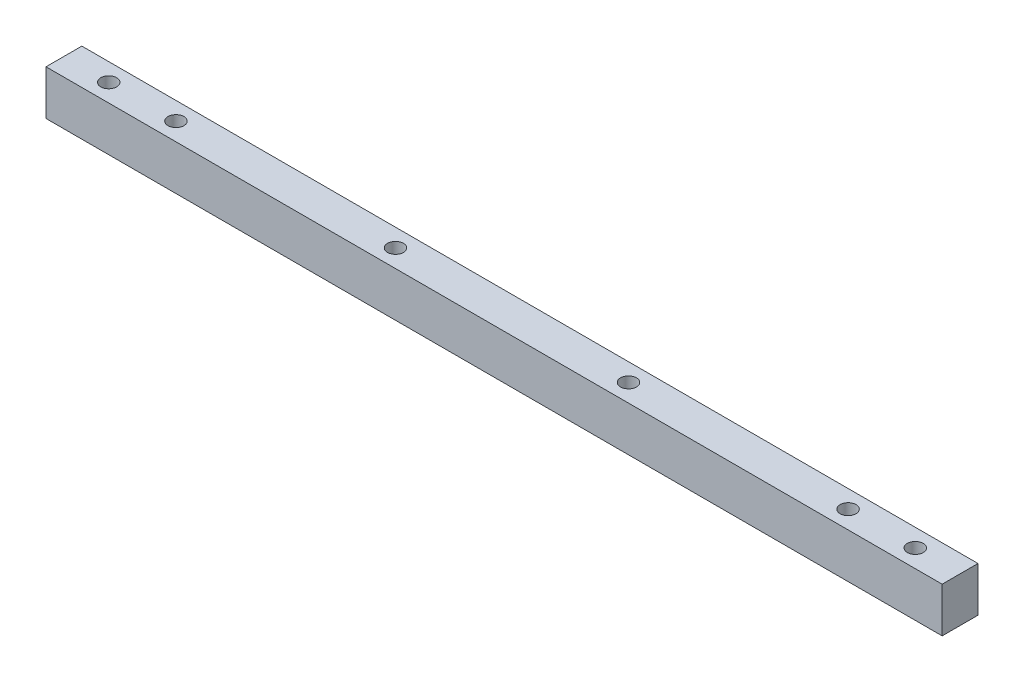
from build123d import *

# Parameters (mm, degrees)
SKETCH1_W           = 200
SKETCH1_H           = 8
BOSS_EXTRUDE1_DEPTH = 10
SKETCH2_R           = 1.775
CUT_EXTRUDE1_DEPTH  = 108.045777637
SKETCH3_R           = 1.775
CUT_EXTRUDE2_DEPTH  = 108.045777637


with BuildPart() as part:
    # Sketch1 → Boss-Extrude1 (new body)
    with BuildSketch(Plane(origin=(0, 0, 0), x_dir=(1, 0, 0), z_dir=(0, 1, 0))):
        with Locations((6.494727973, 0.203739262)):
            Rectangle(SKETCH1_W, SKETCH1_H)
    extrude(amount=BOSS_EXTRUDE1_DEPTH)

    # Sketch2 → Cut-Extrude1 (cut, through all)
    with BuildSketch(Plane(origin=(0, 10, 0), x_dir=(1, 0, 0), z_dir=(0, 1, 0))):
        with Locations(Location((-19.505272027, 0.203739262, 0), (0, 0, 270))):
            Circle(SKETCH2_R)
        with Locations(Location((32.494727973, 0.203739262, 0), (0, 0, 270))):
            Circle(SKETCH2_R)
    extrude(amount=-CUT_EXTRUDE1_DEPTH, mode=Mode.SUBTRACT)

    # Sketch3 → Cut-Extrude2 (cut, through all)
    with BuildSketch(Plane(origin=(0, 10, 0), x_dir=(1, 0, 0), z_dir=(0, 1, 0))):
        with Locations(Location((-83.505272027, 0.203739262, 0), (0, 0, 270))):
            Circle(SKETCH3_R)
        with Locations(Location((-68.505272027, 0.203739262, 0), (0, 0, 270))):
            Circle(SKETCH3_R)
        with Locations(Location((81.494727973, 0.203739262, 0), (0, 0, 270))):
            Circle(SKETCH3_R)
        with Locations(Location((96.494727973, 0.203739262, 0), (0, 0, 270))):
            Circle(SKETCH3_R)
    extrude(amount=-CUT_EXTRUDE2_DEPTH, mode=Mode.SUBTRACT)


solid = part.part
